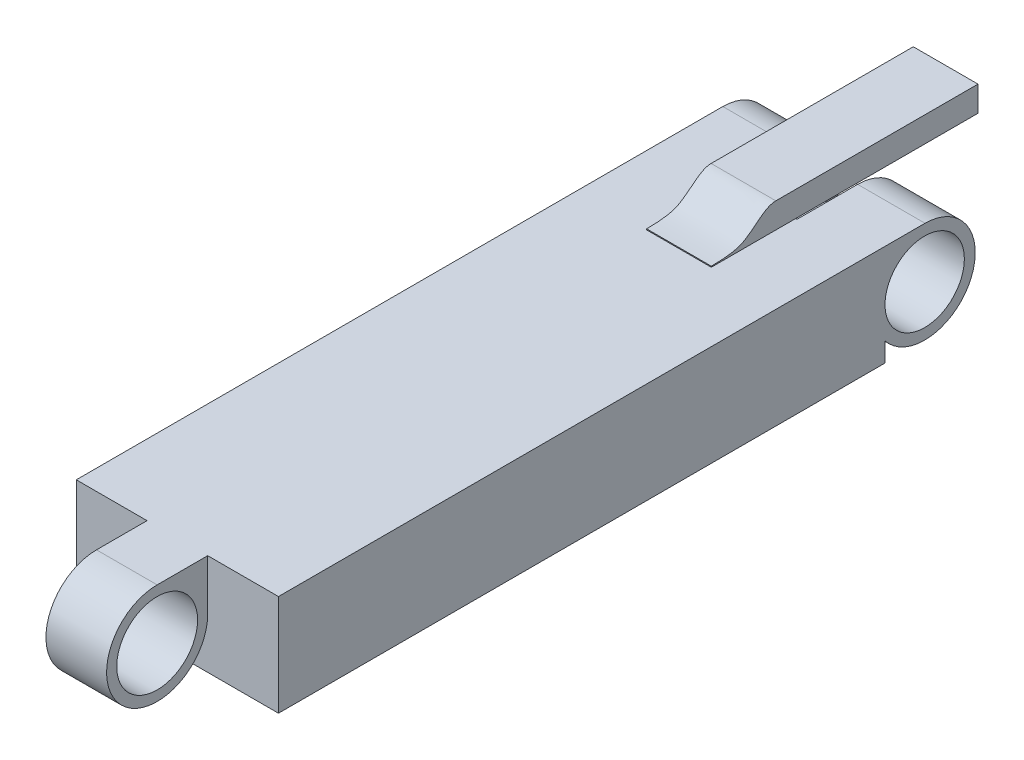
from build123d import *

# Parameters (mm, degrees)
BOSS_EXTRUDE1_DEPTH      = 10
SKETCH4_R                = 1.962636903
CUT_EXTRUDE2_DEPTH       = 10
SKETCH6_R                = 2.5
SKETCH6_R_2              = 1.962636903
BOSS_EXTRUDE2_DEPTH      = 3.333333333
BOSS_EXTRUDE3_START      = -3.333333333
SKETCH7_R                = 2.5
SKETCH7_R_2              = 1.962636903
BOSS_EXTRUDE3_DEPTH      = 3.333333333
SKETCH9_W                = 3.333333334
SKETCH9_H                = 5
CUT_EXTRUDE7_DEPTH       = 3
SKETCH10_W               = 3.333333334
SKETCH10_H               = 1.037363097
CUT_EXTRUDE8_DEPTH       = 37.201372358
BOSS_EXTRUDE4_DEPTH      = 1.5
BOSS_EXTRUDE4_DEPTH_BACK = 1.5
SKETCH12_R               = 2
BOSS_EXTRUDE9_DEPTH      = 1.6
BOSS_EXTRUDE9_DEPTH_BACK = 1.6


with BuildPart() as part:
    # Sketch3 → Boss-Extrude1 (new body)
    with BuildSketch(Plane(origin=(0, 0, 0), x_dir=(0, 0, -1), z_dir=(1, 0, 0))):
        Polygon((0, 5), (0, 0), (30, 0), (30, 2.5), (31.962636903, 2.5), (31.97894003, 5), (30, 5), align=None)
    extrude(amount=BOSS_EXTRUDE1_DEPTH)

    # Sketch4 → Cut-Extrude2 (cut)
    with BuildSketch(Plane(origin=(0, 0, 0), x_dir=(0, 0, -1), z_dir=(1, 0, 0))):
        with Locations((31.962636903, 2.5)):
            Circle(SKETCH4_R)
    extrude(amount=CUT_EXTRUDE2_DEPTH, mode=Mode.SUBTRACT)

    # Sketch6 → Boss-Extrude2 (add)
    with BuildSketch(Plane.ZY):
        with Locations((-31.962636903, 2.5)):
            Circle(SKETCH6_R)
        with Locations((-31.962636903, 2.5)):
            Circle(SKETCH6_R_2, mode=Mode.SUBTRACT)
    extrude(amount=-BOSS_EXTRUDE2_DEPTH)

    # Sketch7 → Boss-Extrude3 (add)
    with BuildSketch(Plane(origin=(10, 0, 0), x_dir=(0, 0, -1), z_dir=(1, 0, 0)).offset(BOSS_EXTRUDE3_START)):
        with Locations((31.962636903, 2.5)):
            Circle(SKETCH7_R)
        with Locations((31.962636903, 2.5)):
            Circle(SKETCH7_R_2, mode=Mode.SUBTRACT)
    extrude(amount=BOSS_EXTRUDE3_DEPTH)

    # Sketch9 → Cut-Extrude7 (cut)
    with BuildSketch(Plane(origin=(0, -0.208321197, -31.944975261), x_dir=(-1, 0, 0), z_dir=(0, -0.006521112201233067, -0.9999787373217788))):
        with Locations((-5, 2.708378785)):
            Rectangle(SKETCH9_W, SKETCH9_H)
    extrude(amount=-CUT_EXTRUDE7_DEPTH, mode=Mode.SUBTRACT)

    # Sketch10 → Cut-Extrude8 (cut, through all)
    with BuildSketch(Plane(origin=(0, 0.208374354, -0.001358861), x_dir=(1, 0, 0), z_dir=(0, 0.9999787373217788, -0.00652111220123307))):
        with Locations((5, 29.464336059)):
            Rectangle(SKETCH10_W, SKETCH10_H)
    extrude(amount=-CUT_EXTRUDE8_DEPTH, mode=Mode.SUBTRACT)

    # Sketch12 → Boss-Extrude4 (add, two sides: drawn at the far end of the back side and taken through both)
    with BuildSketch(Plane(origin=(5, 0, 0), x_dir=(0, 0, -1), z_dir=(1, 0, 0)).offset(-BOSS_EXTRUDE4_DEPTH_BACK)):
        with BuildLine():
            Line((-2.5, 5), (0, 5))
            Line((0, 5), (0, 2.5))
            ThreePointArc((0, 2.5), (-4.267766953, 0.732233047), (-2.5, 5))
        make_face()
        with Locations((-2.5, 2.5)):
            Circle(SKETCH12_R, mode=Mode.SUBTRACT)
    extrude(amount=BOSS_EXTRUDE4_DEPTH + BOSS_EXTRUDE4_DEPTH_BACK)

    # Sketch13 → Boss-Extrude9 (add, two sides: drawn at the far end of the back side and taken through both)
    with BuildSketch(Plane(origin=(5, 0, 0), x_dir=(0, 0, -1), z_dir=(1, 0, 0)).offset(-BOSS_EXTRUDE9_DEPTH_BACK)):
        with BuildLine():
            Line((24.809137755, 5), (28, 5))
            Line((28, 5), (38, 5))
            Line((38, 5), (38, 6.25))
            Line((38, 6.25), (28, 6.25))
            add(Edge.make_bspline(
                [(28, 6.25), (27.570139782, 6.25), (27.108034748, 5.787413316), (26.444737385, 5.323894947), (26.11400028, 5.04700236), (24.809137755, 5.04700236)],
                knots=[0, 0, 0, 0, 0.435997525, 0.535997525, 1, 1, 1, 1], degree=3))
            Line((24.809137755, 5.04700236), (24.809137755, 5))
        make_face()
    extrude(amount=BOSS_EXTRUDE9_DEPTH + BOSS_EXTRUDE9_DEPTH_BACK)


solid = part.part
